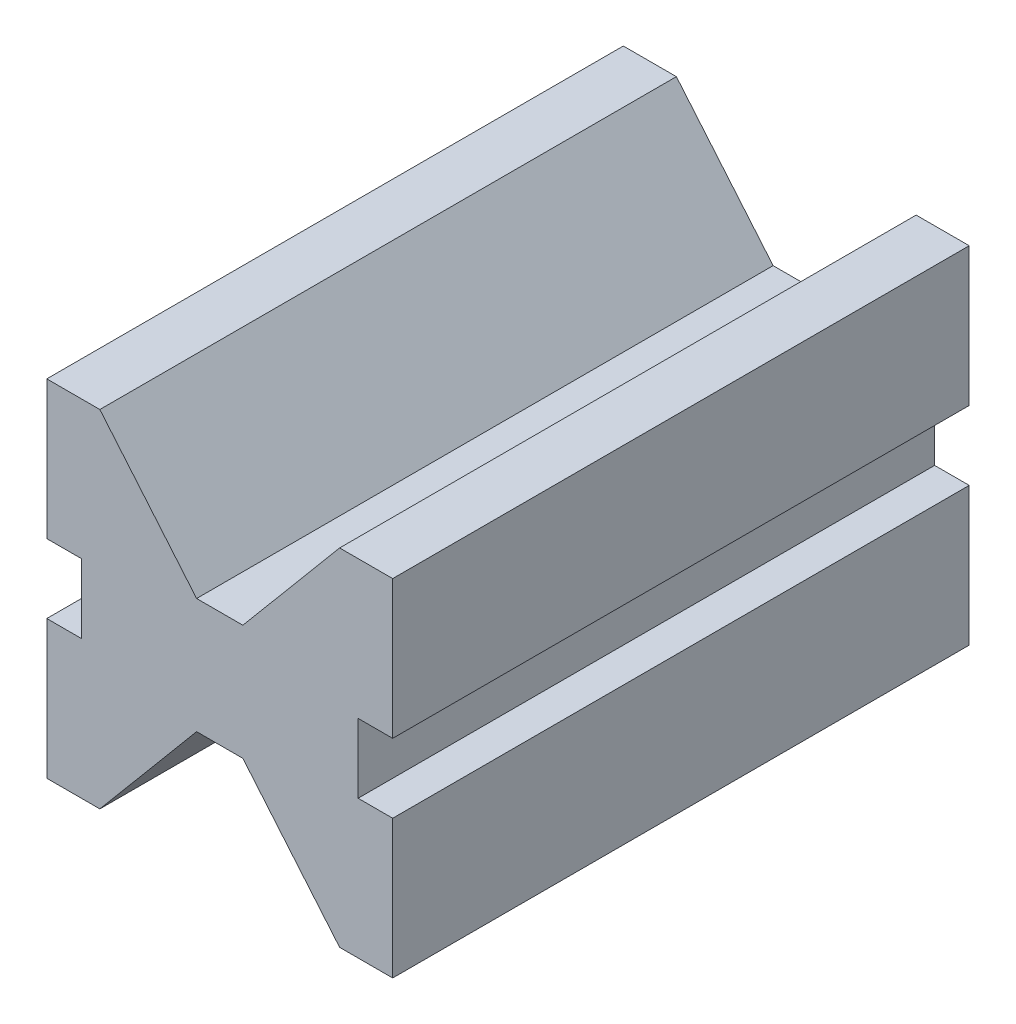
from build123d import *

# Parameters (mm, degrees)
BOSS_EXTRUDE1_DEPTH = 50


with BuildPart() as part:
    # Sketch2 → Boss-Extrude1 (new, symmetric)
    with BuildSketch(Plane.XY):
        Polygon((-30, 30), (-30, 6), (-24, 6), (-24, -6), (-30, -6), (-30, -30), (-20.794701987, -30), (-4.012709363, -10), (4.012709363, -10), (20.794701987, -30), (30, -30), (30, -6), (24, -6), (24, 6), (30, 6), (30, 30), (20.794701987, 30), (4.012709363, 10), (-4.012709363, 10), (-20.794701987, 30), align=None)
    extrude(amount=BOSS_EXTRUDE1_DEPTH, both=True)


solid = part.part
